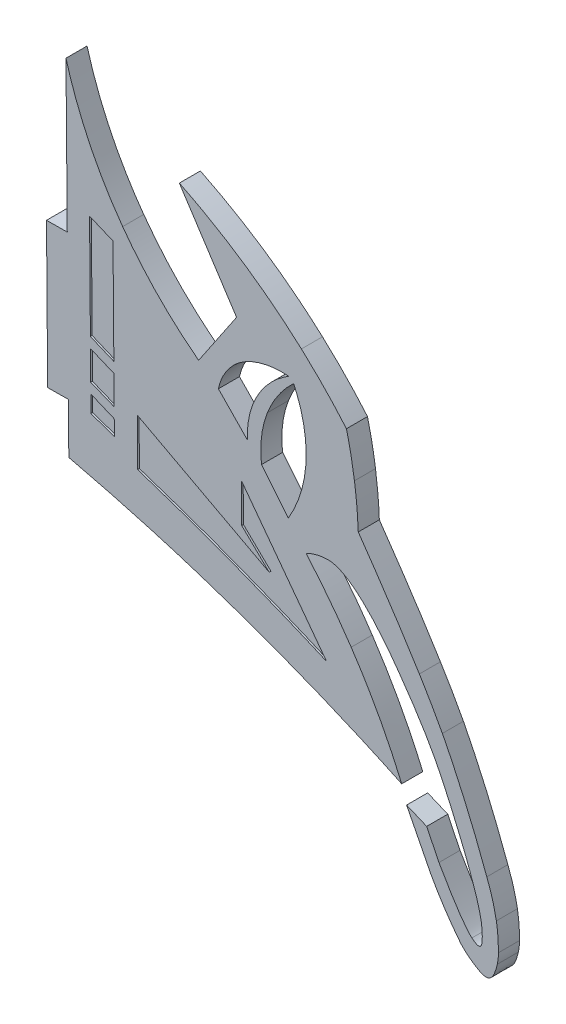
from build123d import *

# Parameters (mm, degrees)
BOSS_EXTRUDE1_DEPTH = 5.5
BOSS_EXTRUDE2_DEPTH = 6


with BuildPart() as part:
    # Model → Boss-Extrude1 (new body)
    with BuildSketch(Plane.XY):
        with BuildLine():
            add(Edge.make_bspline(
                [(88.981982, 91.760914), (92.363957, 86.917406), (99.815323, 76.122871), (106.385338, 65.435092)],
                knots=[0, 0, 0, 0, 1, 1, 1, 1], degree=3))
            add(Edge.make_bspline(
                [(87.891561, 103.84013), (88.509584, 99.509618), (88.840383, 95.462356), (88.981982, 91.760914)],
                knots=[0, 0, 0, 0, 1, 1, 1, 1], degree=3))
            add(Edge.make_bspline(
                [(85.611589, 115.543522), (86.490757, 111.995641), (87.286064, 108.082888), (87.891561, 103.84013)],
                knots=[0, 0, 0, 0, 1, 1, 1, 1], degree=3))
            add(Edge.make_bspline(
                [(72.784787, 128.810737), (77.747399, 124.303832), (81.991983, 119.814066), (85.611589, 115.543522)],
                knots=[0, 0, 0, 0, 1, 1, 1, 1], degree=3))
            add(Edge.make_bspline(
                [(38.012231, 152.341642), (48.270421, 147.288036), (60.66697, 139.81578), (72.784787, 128.810737)],
                knots=[0, 0, 0, 0, 1, 1, 1, 1], degree=3))
            add(Edge.make_bspline(
                [(54.311496, 127.380612), (48.878404, 135.700955), (43.445323, 144.021299), (38.012231, 152.341642)],
                knots=[0, 0, 0, 0, 1, 1, 1, 1], degree=3))
            add(Edge.make_bspline(
                [(43.507797, 111.359871), (47.109032, 116.700118), (50.710267, 122.040365), (54.311496, 127.380612)],
                knots=[0, 0, 0, 0, 1, 1, 1, 1], degree=3))
            add(Edge.make_bspline(
                [(21.864317, 133.530813), (29.31379, 123.229216), (37.340577, 116.054987), (43.507797, 111.359871)],
                knots=[0, 0, 0, 0, 1, 1, 1, 1], degree=3))
            add(Edge.make_bspline(
                [(5.717257, 167.009871), (8.055161, 158.682458), (12.612237, 146.32518), (21.864317, 133.530813)],
                knots=[0, 0, 0, 0, 1, 1, 1, 1], degree=3))
            add(Edge.make_bspline(
                [(6.085667, 124.295169), (5.96286, 138.53341), (5.840063, 152.77164), (5.717257, 167.009871)],
                knots=[0, 0, 0, 0, 1, 1, 1, 1], degree=3))
            add(Edge.make_bspline(
                [(0.173267, 124.247788), (2.144063, 124.263581), (4.114871, 124.279375), (6.085667, 124.295169)],
                knots=[0, 0, 0, 0, 1, 1, 1, 1], degree=3))
            add(Edge.make_bspline(
                [(0.502123, 83.133038), (0.392504, 96.837958), (0.282886, 110.542868), (0.173267, 124.247788)],
                knots=[0, 0, 0, 0, 1, 1, 1, 1], degree=3))
            add(Edge.make_bspline(
                [(6.414522, 83.18043), (4.443725, 83.164636), (2.472919, 83.148832), (0.502123, 83.133038)],
                knots=[0, 0, 0, 0, 1, 1, 1, 1], degree=3))
            add(Edge.make_bspline(
                [(6.528642, 68.912687), (6.490602, 73.668595), (6.452563, 78.424523), (6.414522, 83.18043)],
                knots=[0, 0, 0, 0, 1, 1, 1, 1], degree=3))
            add(Edge.make_bspline(
                [(43.730926, 58.614183), (30.735145, 62.791639), (18.28489, 66.170721), (6.528642, 68.912687)],
                knots=[0, 0, 0, 0, 1, 1, 1, 1], degree=3))
            add(Edge.make_bspline(
                [(101.35509, 35.815897), (84.53816, 43.780864), (65.298878, 51.681228), (43.730926, 58.614183)],
                knots=[0, 0, 0, 0, 1, 1, 1, 1], degree=3))
            add(Edge.make_bspline(
                [(86.964852, 62.318482), (93.362772, 52.778903), (97.984925, 43.715829), (101.35509, 35.815897)],
                knots=[0, 0, 0, 0, 1, 1, 1, 1], degree=3))
            add(Edge.make_bspline(
                [(74.110229, 79.065338), (78.310479, 74.255473), (82.695052, 68.684936), (86.964852, 62.318482)],
                knots=[0, 0, 0, 0, 1, 1, 1, 1], degree=3))
            add(Edge.make_bspline(
                [(80.590937, 80.582498), (77.897751, 80.65298), (75.642281, 79.8197), (74.110229, 79.065338)],
                knots=[0, 0, 0, 0, 1, 1, 1, 1], degree=3))
            add(Edge.make_bspline(
                [(100.441215, 63.098051), (88.39152, 79.969592), (82.413726, 80.534798), (80.590937, 80.582498)],
                knots=[0, 0, 0, 0, 1, 1, 1, 1], degree=3))
            add(Edge.make_bspline(
                [(110.901971, 46.587712), (108.506428, 51.100156), (105.38104, 56.181506), (100.441215, 63.098051)],
                knots=[0, 0, 0, 0, 1, 1, 1, 1], degree=3))
            add(Edge.make_bspline(
                [(115.20457, 37.575257), (113.566835, 41.220861), (111.969696, 44.576453), (110.901971, 46.587712)],
                knots=[0, 0, 0, 0, 1, 1, 1, 1], degree=3))
            add(Edge.make_bspline(
                [(118.323821, 30.273752), (116.902767, 33.765765), (115.720916, 36.425875), (115.20457, 37.575257)],
                knots=[0, 0, 0, 0, 1, 1, 1, 1], degree=3))
            add(Edge.make_bspline(
                [(121.058968, 23.224486), (120.024798, 26.099452), (119.151819, 28.239096), (118.323821, 30.273752)],
                knots=[0, 0, 0, 0, 1, 1, 1, 1], degree=3))
            add(Edge.make_bspline(
                [(122.725302, 18.315954), (122.216532, 19.997413), (121.713325, 21.405404), (121.058968, 23.224486)],
                knots=[0, 0, 0, 0, 1, 1, 1, 1], degree=3))
            add(Edge.make_bspline(
                [(123.492953, 15.596882), (123.185539, 16.767041), (122.911774, 17.699667), (122.725302, 18.315954)],
                knots=[0, 0, 0, 0, 1, 1, 1, 1], degree=3))
            add(Edge.make_bspline(
                [(124.19535, 7.963296), (124.612865, 11.093172), (123.768915, 14.546445), (123.492953, 15.596882)],
                knots=[0, 0, 0, 0, 1, 1, 1, 1], degree=3))
            add(Edge.make_bspline(
                [(123.616142, 6.842769), (124.049311, 7.036138), (124.149794, 7.621834), (124.19535, 7.963296)],
                knots=[0, 0, 0, 0, 1, 1, 1, 1], degree=3))
            add(Edge.make_bspline(
                [(121.35585, 7.801474), (121.809384, 7.433356), (122.919924, 6.532), (123.616142, 6.842769)],
                knots=[0, 0, 0, 0, 1, 1, 1, 1], degree=3))
            add(Edge.make_bspline(
                [(111.969132, 21.706761), (113.591522, 18.850734), (118.738636, 9.925725), (121.35585, 7.801474)],
                knots=[0, 0, 0, 0, 1, 1, 1, 1], degree=3))
            add(Edge.make_bspline(
                [(108.466549, 28.882613), (110.039739, 25.726895), (111.247909, 23.217489), (111.969132, 21.706761)],
                knots=[0, 0, 0, 0, 1, 1, 1, 1], degree=3))
            add(Edge.make_bspline(
                [(102.749578, 31.278822), (104.655239, 30.480089), (106.560899, 29.681356), (108.466549, 28.882613)],
                knots=[0, 0, 0, 0, 1, 1, 1, 1], degree=3))
            add(Edge.make_bspline(
                [(109.615408, 17.78067), (106.529016, 23.786888), (104.139006, 28.51763), (102.749578, 31.278822)],
                knots=[0, 0, 0, 0, 1, 1, 1, 1], degree=3))
            add(Edge.make_bspline(
                [(117.998618, 5.088352), (112.729741, 11.752196), (109.615408, 17.78066), (109.615408, 17.78067)],
                knots=[0, 0, 0, 0, 1, 1, 1, 1], degree=3))
            add(Edge.make_bspline(
                [(121.21287, 2.163981), (119.292633, 3.474558), (118.179783, 4.859213), (117.998618, 5.088352)],
                knots=[0, 0, 0, 0, 1, 1, 1, 1], degree=3))
            add(Edge.make_bspline(
                [(126.18586, 0.330996), (124.730532, -0.292937), (122.853921, 1.043926), (121.21287, 2.163981)],
                knots=[0, 0, 0, 0, 1, 1, 1, 1], degree=3))
            add(Edge.make_bspline(
                [(128.577892, 4.922604), (128.232252, 3.468454), (127.643744, 0.956017), (126.18586, 0.330996)],
                knots=[0, 0, 0, 0, 1, 1, 1, 1], degree=3))
            add(Edge.make_bspline(
                [(128.907776, 7.923057), (128.895427, 6.997593), (128.849933, 6.067136), (128.577892, 4.922604)],
                knots=[0, 0, 0, 0, 1, 1, 1, 1], degree=3))
            add(Edge.make_bspline(
                [(128.317236, 15.488565), (128.408326, 14.984448), (128.960137, 11.844451), (128.907776, 7.923057)],
                knots=[0, 0, 0, 0, 1, 1, 1, 1], degree=3))
            add(Edge.make_bspline(
                [(125.591121, 24.990474), (127.095803, 21.178372), (127.881069, 17.902571), (128.317236, 15.488565)],
                knots=[0, 0, 0, 0, 1, 1, 1, 1], degree=3))
            add(Edge.make_bspline(
                [(112.9362, 54.04065), (112.93621, 54.040639), (119.246882, 42.24083), (125.591121, 24.990474)],
                knots=[0, 0, 0, 0, 1, 1, 1, 1], degree=3))
            add(Edge.make_bspline(
                [(106.385338, 65.435092), (108.620656, 61.798787), (110.51327, 58.571077), (112.9362, 54.04065)],
                knots=[0, 0, 0, 0, 1, 1, 1, 1], degree=3))
        make_face()
        with BuildLine():
            add(Edge.make_bspline(
                [(60.991312, 112.286988), (57.336487, 106.516702), (57.29828, 100.939805), (57.423431, 98.636129)],
                knots=[0, 0, 0, 0, 1, 1, 1, 1], degree=3))
            add(Edge.make_bspline(
                [(57.423431, 98.636129), (54.662226, 101.477534), (51.901014, 104.318938), (49.13981, 107.160343)],
                knots=[0, 0, 0, 0, 1, 1, 1, 1], degree=3))
            add(Edge.make_bspline(
                [(49.13981, 107.160343), (49.512663, 108.894743), (50.502678, 112.154678), (53.416078, 115.079573)],
                knots=[0, 0, 0, 0, 1, 1, 1, 1], degree=3))
            add(Edge.make_bspline(
                [(53.416078, 115.079573), (59.342455, 121.029346), (68.027873, 120.372552), (69.176047, 120.268222)],
                knots=[0, 0, 0, 0, 1, 1, 1, 1], degree=3))
            add(Edge.make_bspline(
                [(69.176047, 120.268222), (67.148337, 119.024365), (63.679053, 116.530424), (60.991312, 112.286988)],
                knots=[0, 0, 0, 0, 1, 1, 1, 1], degree=3))
        make_face(mode=Mode.SUBTRACT)
        with BuildLine():
            add(Edge.make_bspline(
                [(70.576112, 119.174936), (68.582839, 117.317104), (65.233673, 113.709263), (63.110556, 108.254113)],
                knots=[0, 0, 0, 0, 1, 1, 1, 1], degree=3))
            add(Edge.make_bspline(
                [(73.63169, 97.477448), (75.381, 107.488406), (72.277648, 115.540635), (70.576112, 119.174936)],
                knots=[0, 0, 0, 0, 1, 1, 1, 1], degree=3))
            add(Edge.make_bspline(
                [(69.058778, 85.229863), (70.739781, 88.062472), (72.711991, 92.214186), (73.63169, 97.477448)],
                knots=[0, 0, 0, 0, 1, 1, 1, 1], degree=3))
            add(Edge.make_bspline(
                [(61.43078, 94.618389), (63.973445, 91.488884), (66.516112, 88.359368), (69.058778, 85.229863)],
                knots=[0, 0, 0, 0, 1, 1, 1, 1], degree=3))
            add(Edge.make_bspline(
                [(63.110556, 108.254113), (60.821746, 102.373218), (61.092169, 97.259972), (61.43078, 94.618389)],
                knots=[0, 0, 0, 0, 1, 1, 1, 1], degree=3))
        make_face(mode=Mode.SUBTRACT)
    extrude(amount=BOSS_EXTRUDE1_DEPTH)

    # Model<3> → Boss-Extrude2 (add)
    with BuildSketch(Plane.XY):
        with BuildLine():
            add(Edge.make_bspline(
                [(88.981982, 91.760914), (92.363957, 86.917406), (99.815323, 76.122871), (106.385338, 65.435092)],
                knots=[0, 0, 0, 0, 1, 1, 1, 1], degree=3))
            add(Edge.make_bspline(
                [(106.385338, 65.435092), (108.620656, 61.798787), (110.51327, 58.571077), (112.9362, 54.04065)],
                knots=[0, 0, 0, 0, 1, 1, 1, 1], degree=3))
            add(Edge.make_bspline(
                [(112.9362, 54.04065), (112.93621, 54.040639), (119.246882, 42.24083), (125.591121, 24.990474)],
                knots=[0, 0, 0, 0, 1, 1, 1, 1], degree=3))
            add(Edge.make_bspline(
                [(125.591121, 24.990474), (127.095803, 21.178372), (127.881069, 17.902571), (128.317236, 15.488565)],
                knots=[0, 0, 0, 0, 1, 1, 1, 1], degree=3))
            add(Edge.make_bspline(
                [(128.317236, 15.488565), (128.408326, 14.984448), (128.960137, 11.844451), (128.907776, 7.923057)],
                knots=[0, 0, 0, 0, 1, 1, 1, 1], degree=3))
            add(Edge.make_bspline(
                [(128.907776, 7.923057), (128.895427, 6.997593), (128.849933, 6.067136), (128.577892, 4.922604)],
                knots=[0, 0, 0, 0, 1, 1, 1, 1], degree=3))
            add(Edge.make_bspline(
                [(128.577892, 4.922604), (128.232252, 3.468454), (127.643744, 0.956017), (126.18586, 0.330996)],
                knots=[0, 0, 0, 0, 1, 1, 1, 1], degree=3))
            add(Edge.make_bspline(
                [(126.18586, 0.330996), (124.730532, -0.292937), (122.853921, 1.043926), (121.21287, 2.163981)],
                knots=[0, 0, 0, 0, 1, 1, 1, 1], degree=3))
            add(Edge.make_bspline(
                [(121.21287, 2.163981), (119.292633, 3.474558), (118.179783, 4.859213), (117.998618, 5.088352)],
                knots=[0, 0, 0, 0, 1, 1, 1, 1], degree=3))
            add(Edge.make_bspline(
                [(117.998618, 5.088352), (112.729741, 11.752196), (109.615408, 17.78066), (109.615408, 17.78067)],
                knots=[0, 0, 0, 0, 1, 1, 1, 1], degree=3))
            add(Edge.make_bspline(
                [(109.615408, 17.78067), (106.529016, 23.786888), (104.139006, 28.51763), (102.749578, 31.278822)],
                knots=[0, 0, 0, 0, 1, 1, 1, 1], degree=3))
            add(Edge.make_bspline(
                [(102.749578, 31.278822), (104.655239, 30.480089), (106.560899, 29.681356), (108.466549, 28.882613)],
                knots=[0, 0, 0, 0, 1, 1, 1, 1], degree=3))
            add(Edge.make_bspline(
                [(108.466549, 28.882613), (110.039739, 25.726895), (111.247909, 23.217489), (111.969132, 21.706761)],
                knots=[0, 0, 0, 0, 1, 1, 1, 1], degree=3))
            add(Edge.make_bspline(
                [(111.969132, 21.706761), (113.591522, 18.850734), (118.738636, 9.925725), (121.35585, 7.801474)],
                knots=[0, 0, 0, 0, 1, 1, 1, 1], degree=3))
            add(Edge.make_bspline(
                [(121.35585, 7.801474), (121.809384, 7.433356), (122.919924, 6.532), (123.616142, 6.842769)],
                knots=[0, 0, 0, 0, 1, 1, 1, 1], degree=3))
            add(Edge.make_bspline(
                [(123.616142, 6.842769), (124.049311, 7.036138), (124.149794, 7.621834), (124.19535, 7.963296)],
                knots=[0, 0, 0, 0, 1, 1, 1, 1], degree=3))
            add(Edge.make_bspline(
                [(124.19535, 7.963296), (124.612865, 11.093172), (123.768915, 14.546445), (123.492953, 15.596882)],
                knots=[0, 0, 0, 0, 1, 1, 1, 1], degree=3))
            add(Edge.make_bspline(
                [(123.492953, 15.596882), (123.185539, 16.767041), (122.911774, 17.699667), (122.725302, 18.315954)],
                knots=[0, 0, 0, 0, 1, 1, 1, 1], degree=3))
            add(Edge.make_bspline(
                [(122.725302, 18.315954), (122.216532, 19.997413), (121.713325, 21.405404), (121.058968, 23.224486)],
                knots=[0, 0, 0, 0, 1, 1, 1, 1], degree=3))
            add(Edge.make_bspline(
                [(121.058968, 23.224486), (120.024798, 26.099452), (119.151819, 28.239096), (118.323821, 30.273752)],
                knots=[0, 0, 0, 0, 1, 1, 1, 1], degree=3))
            add(Edge.make_bspline(
                [(118.323821, 30.273752), (116.902767, 33.765765), (115.720916, 36.425875), (115.20457, 37.575257)],
                knots=[0, 0, 0, 0, 1, 1, 1, 1], degree=3))
            add(Edge.make_bspline(
                [(115.20457, 37.575257), (113.566835, 41.220861), (111.969696, 44.576453), (110.901971, 46.587712)],
                knots=[0, 0, 0, 0, 1, 1, 1, 1], degree=3))
            add(Edge.make_bspline(
                [(110.901971, 46.587712), (108.506428, 51.100156), (105.38104, 56.181506), (100.441215, 63.098051)],
                knots=[0, 0, 0, 0, 1, 1, 1, 1], degree=3))
            add(Edge.make_bspline(
                [(100.441215, 63.098051), (88.39152, 79.969592), (82.413726, 80.534798), (80.590937, 80.582498)],
                knots=[0, 0, 0, 0, 1, 1, 1, 1], degree=3))
            add(Edge.make_bspline(
                [(80.590937, 80.582498), (77.897751, 80.65298), (75.642281, 79.8197), (74.110229, 79.065338)],
                knots=[0, 0, 0, 0, 1, 1, 1, 1], degree=3))
            add(Edge.make_bspline(
                [(74.110229, 79.065338), (78.310479, 74.255473), (82.695052, 68.684936), (86.964852, 62.318482)],
                knots=[0, 0, 0, 0, 1, 1, 1, 1], degree=3))
            add(Edge.make_bspline(
                [(86.964852, 62.318482), (93.362772, 52.778903), (97.984925, 43.715829), (101.35509, 35.815897)],
                knots=[0, 0, 0, 0, 1, 1, 1, 1], degree=3))
            add(Edge.make_bspline(
                [(101.35509, 35.815897), (84.53816, 43.780864), (65.298878, 51.681228), (43.730926, 58.614183)],
                knots=[0, 0, 0, 0, 1, 1, 1, 1], degree=3))
            add(Edge.make_bspline(
                [(43.730926, 58.614183), (30.735145, 62.791639), (18.28489, 66.170721), (6.528642, 68.912687)],
                knots=[0, 0, 0, 0, 1, 1, 1, 1], degree=3))
            add(Edge.make_bspline(
                [(6.528642, 68.912687), (6.490602, 73.668595), (6.452563, 78.424523), (6.414522, 83.18043)],
                knots=[0, 0, 0, 0, 1, 1, 1, 1], degree=3))
            add(Edge.make_bspline(
                [(6.414522, 83.18043), (4.443725, 83.164636), (2.472919, 83.148832), (0.502123, 83.133038)],
                knots=[0, 0, 0, 0, 1, 1, 1, 1], degree=3))
            add(Edge.make_bspline(
                [(0.502123, 83.133038), (0.392504, 96.837958), (0.282886, 110.542868), (0.173267, 124.247788)],
                knots=[0, 0, 0, 0, 1, 1, 1, 1], degree=3))
            add(Edge.make_bspline(
                [(0.173267, 124.247788), (2.144063, 124.263581), (4.114871, 124.279375), (6.085667, 124.295169)],
                knots=[0, 0, 0, 0, 1, 1, 1, 1], degree=3))
            add(Edge.make_bspline(
                [(6.085667, 124.295169), (5.96286, 138.53341), (5.840063, 152.77164), (5.717257, 167.009871)],
                knots=[0, 0, 0, 0, 1, 1, 1, 1], degree=3))
            add(Edge.make_bspline(
                [(5.717257, 167.009871), (8.055161, 158.682458), (12.612237, 146.32518), (21.864317, 133.530813)],
                knots=[0, 0, 0, 0, 1, 1, 1, 1], degree=3))
            add(Edge.make_bspline(
                [(21.864317, 133.530813), (29.31379, 123.229216), (37.340577, 116.054987), (43.507797, 111.359871)],
                knots=[0, 0, 0, 0, 1, 1, 1, 1], degree=3))
            add(Edge.make_bspline(
                [(43.507797, 111.359871), (47.109032, 116.700118), (50.710267, 122.040365), (54.311496, 127.380612)],
                knots=[0, 0, 0, 0, 1, 1, 1, 1], degree=3))
            add(Edge.make_bspline(
                [(54.311496, 127.380612), (48.878404, 135.700955), (43.445323, 144.021299), (38.012231, 152.341642)],
                knots=[0, 0, 0, 0, 1, 1, 1, 1], degree=3))
            add(Edge.make_bspline(
                [(38.012231, 152.341642), (48.270421, 147.288036), (60.66697, 139.81578), (72.784787, 128.810737)],
                knots=[0, 0, 0, 0, 1, 1, 1, 1], degree=3))
            add(Edge.make_bspline(
                [(72.784787, 128.810737), (77.747399, 124.303832), (81.991983, 119.814066), (85.611589, 115.543522)],
                knots=[0, 0, 0, 0, 1, 1, 1, 1], degree=3))
            add(Edge.make_bspline(
                [(85.611589, 115.543522), (86.490757, 111.995641), (87.286064, 108.082888), (87.891561, 103.84013)],
                knots=[0, 0, 0, 0, 1, 1, 1, 1], degree=3))
            add(Edge.make_bspline(
                [(87.891561, 103.84013), (88.509584, 99.509618), (88.840383, 95.462356), (88.981982, 91.760914)],
                knots=[0, 0, 0, 0, 1, 1, 1, 1], degree=3))
        make_face()
        with BuildLine():
            add(Edge.make_bspline(
                [(57.423431, 98.636129), (54.662226, 101.477534), (51.901014, 104.318938), (49.13981, 107.160343)],
                knots=[0, 0, 0, 0, 1, 1, 1, 1], degree=3))
            add(Edge.make_bspline(
                [(49.13981, 107.160343), (49.512663, 108.894743), (50.502678, 112.154678), (53.416078, 115.079573)],
                knots=[0, 0, 0, 0, 1, 1, 1, 1], degree=3))
            add(Edge.make_bspline(
                [(53.416078, 115.079573), (59.342455, 121.029346), (68.027873, 120.372552), (69.176047, 120.268222)],
                knots=[0, 0, 0, 0, 1, 1, 1, 1], degree=3))
            add(Edge.make_bspline(
                [(69.176047, 120.268222), (67.148337, 119.024365), (63.679053, 116.530424), (60.991312, 112.286988)],
                knots=[0, 0, 0, 0, 1, 1, 1, 1], degree=3))
            add(Edge.make_bspline(
                [(60.991312, 112.286988), (57.336487, 106.516702), (57.29828, 100.939805), (57.423431, 98.636129)],
                knots=[0, 0, 0, 0, 1, 1, 1, 1], degree=3))
        make_face(mode=Mode.SUBTRACT)
        with BuildLine():
            add(Edge.make_bspline(
                [(70.576112, 119.174936), (68.582839, 117.317104), (65.233673, 113.709263), (63.110556, 108.254113)],
                knots=[0, 0, 0, 0, 1, 1, 1, 1], degree=3))
            add(Edge.make_bspline(
                [(63.110556, 108.254113), (60.821746, 102.373218), (61.092169, 97.259972), (61.43078, 94.618389)],
                knots=[0, 0, 0, 0, 1, 1, 1, 1], degree=3))
            add(Edge.make_bspline(
                [(61.43078, 94.618389), (63.973445, 91.488884), (66.516112, 88.359368), (69.058778, 85.229863)],
                knots=[0, 0, 0, 0, 1, 1, 1, 1], degree=3))
            add(Edge.make_bspline(
                [(69.058778, 85.229863), (70.739781, 88.062472), (72.711991, 92.214186), (73.63169, 97.477448)],
                knots=[0, 0, 0, 0, 1, 1, 1, 1], degree=3))
            add(Edge.make_bspline(
                [(73.63169, 97.477448), (75.381, 107.488406), (72.277648, 115.540635), (70.576112, 119.174936)],
                knots=[0, 0, 0, 0, 1, 1, 1, 1], degree=3))
        make_face(mode=Mode.SUBTRACT)
        with BuildLine():
            add(Edge.make_bspline(
                [(55.777699, 76.737946), (55.748253, 80.419392), (55.718807, 84.100848), (55.689361, 87.782304)],
                knots=[0, 0, 0, 0, 1, 1, 1, 1], degree=3))
            add(Edge.make_bspline(
                [(55.689361, 87.782304), (63.770473, 76.965636), (71.851581, 66.148978), (79.932695, 55.332299)],
                knots=[0, 0, 0, 0, 1, 1, 1, 1], degree=3))
            add(Edge.make_bspline(
                [(79.932695, 55.332299), (71.774534, 58.880982), (63.196259, 62.397575), (54.20534, 65.824778)],
                knots=[0, 0, 0, 0, 1, 1, 1, 1], degree=3))
            add(Edge.make_bspline(
                [(54.20534, 65.824778), (44.548868, 69.505679), (35.176646, 72.793667), (26.14224, 75.735312)],
                knots=[0, 0, 0, 0, 1, 1, 1, 1], degree=3))
            add(Edge.make_bspline(
                [(26.14224, 75.735312), (26.106587, 80.19276), (26.070934, 84.650209), (26.035281, 89.107658)],
                knots=[0, 0, 0, 0, 1, 1, 1, 1], degree=3))
            add(Edge.make_bspline(
                [(26.035281, 89.107658), (38.557032, 82.451038), (51.078779, 75.794428), (63.600531, 69.137808)],
                knots=[0, 0, 0, 0, 1, 1, 1, 1], degree=3))
            add(Edge.make_bspline(
                [(63.600531, 69.137808), (60.992923, 71.671177), (58.385308, 74.204567), (55.777699, 76.737946)],
                knots=[0, 0, 0, 0, 1, 1, 1, 1], degree=3))
        make_face(mode=Mode.SUBTRACT)
        with BuildLine():
            add(Edge.make_bspline(
                [(19.121055, 128.606096), (16.8941, 129.539348), (14.667139, 130.472601), (12.440185, 131.405853)],
                knots=[0, 0, 0, 0, 1, 1, 1, 1], degree=3))
            add(Edge.make_bspline(
                [(12.440185, 131.405853), (12.519048, 121.54603), (12.597912, 111.686207), (12.676775, 101.826385)],
                knots=[0, 0, 0, 0, 1, 1, 1, 1], degree=3))
            add(Edge.make_bspline(
                [(12.676775, 101.826385), (14.90373, 100.893132), (17.130691, 99.95989), (19.357645, 99.026628)],
                knots=[0, 0, 0, 0, 1, 1, 1, 1], degree=3))
            add(Edge.make_bspline(
                [(19.357645, 99.026628), (19.278782, 108.886461), (19.199918, 118.746273), (19.121055, 128.606096)],
                knots=[0, 0, 0, 0, 1, 1, 1, 1], degree=3))
        make_face(mode=Mode.SUBTRACT)
        with BuildLine():
            add(Edge.make_bspline(
                [(19.381305, 96.068686), (17.15435, 97.001938), (14.927389, 97.935191), (12.700434, 98.868443)],
                knots=[0, 0, 0, 0, 1, 1, 1, 1], degree=3))
            add(Edge.make_bspline(
                [(12.700434, 98.868443), (12.722519, 96.107353), (12.744603, 93.346264), (12.766688, 90.585174)],
                knots=[0, 0, 0, 0, 1, 1, 1, 1], degree=3))
            add(Edge.make_bspline(
                [(12.766688, 90.585174), (14.993397, 89.682595), (17.220113, 88.780026), (19.446822, 87.877447)],
                knots=[0, 0, 0, 0, 1, 1, 1, 1], degree=3))
            add(Edge.make_bspline(
                [(19.446822, 87.877447), (19.424983, 90.607863), (19.403144, 93.338269), (19.381305, 96.068686)],
                knots=[0, 0, 0, 0, 1, 1, 1, 1], degree=3))
        make_face(mode=Mode.SUBTRACT)
        with BuildLine():
            add(Edge.make_bspline(
                [(19.470481, 84.919505), (17.243527, 85.852757), (15.016565, 86.78601), (12.789611, 87.719262)],
                knots=[0, 0, 0, 0, 1, 1, 1, 1], degree=3))
            add(Edge.make_bspline(
                [(12.789611, 87.719262), (12.802542, 86.102663), (12.815471, 84.486054), (12.828402, 82.869455)],
                knots=[0, 0, 0, 0, 1, 1, 1, 1], degree=3))
            add(Edge.make_bspline(
                [(12.828402, 82.869455), (15.053939, 82.113459), (17.279482, 81.357463), (19.505019, 80.601467)],
                knots=[0, 0, 0, 0, 1, 1, 1, 1], degree=3))
            add(Edge.make_bspline(
                [(19.505019, 80.601467), (19.493507, 82.04081), (19.481994, 83.480163), (19.470481, 84.919505)],
                knots=[0, 0, 0, 0, 1, 1, 1, 1], degree=3))
        make_face(mode=Mode.SUBTRACT)
    extrude(amount=BOSS_EXTRUDE2_DEPTH)


solid = part.part
